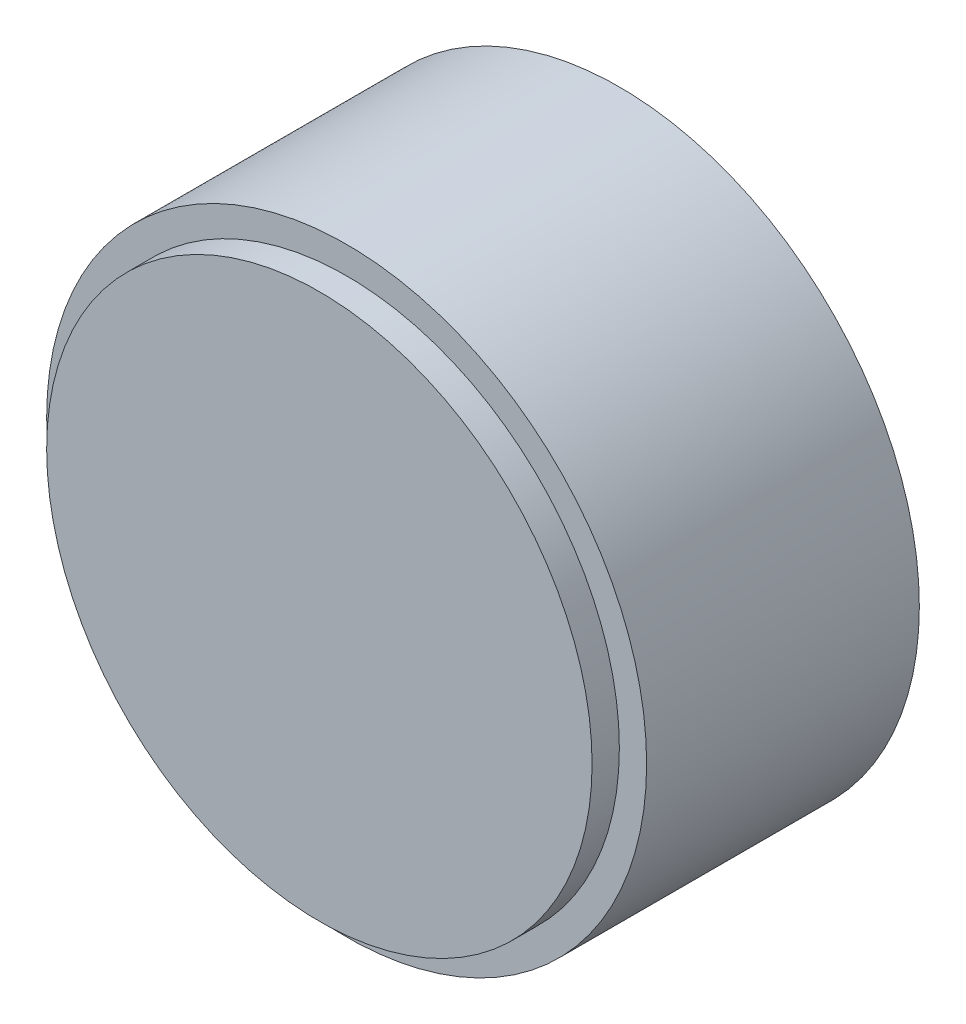
from build123d import *

# Parameters (mm, degrees)
ESQUISSE1_R             = 30
BOSS_EXTRU_1_DEPTH      = 35
BOSS_EXTRU_2_START      = -2
ESQUISSE3_R             = 33
ESQUISSE3_R_2           = 30
BOSS_EXTRU_2_DEPTH      = 30
ESQUISSE4_R             = 7
ESQUISSE4_R_2           = 2
BOSS_EXTRU_3_DEPTH      = 5
ESQUISSE5_R             = 1.5
ENL_V_MAT_EXTRU_1_DEPTH = 59.335238064


with BuildPart() as part:
    # Esquisse1 → Boss.-Extru.1 (new body)
    with BuildSketch(Plane.XY):
        Circle(ESQUISSE1_R)
    extrude(amount=BOSS_EXTRU_1_DEPTH)

    # Esquisse3 → Boss.-Extru.2 (add)
    with BuildSketch(Plane(origin=(0, 0, 0), x_dir=(-1, 0, 0), z_dir=(0, 0, -1)).offset(BOSS_EXTRU_2_START)):
        Circle(ESQUISSE3_R)
        Circle(ESQUISSE3_R_2, mode=Mode.SUBTRACT)
    extrude(amount=-BOSS_EXTRU_2_DEPTH)

    # Esquisse4 → Boss.-Extru.3 (add)
    with BuildSketch(Plane(origin=(0, 0, 0), x_dir=(-1, 0, 0), z_dir=(0, 0, -1))):
        Circle(ESQUISSE4_R)
        Circle(ESQUISSE4_R_2, mode=Mode.SUBTRACT)
    extrude(amount=BOSS_EXTRU_3_DEPTH)

    # Esquisse5 → Enlèv. mat.-Extru.1 (cut, through all)
    with BuildSketch(Plane(origin=(0, 0, 0), x_dir=(1, 0, 0), z_dir=(0, 1, 0))):
        with Locations(Location((0, 2.5, 0), (0, 0, 90))):
            Circle(ESQUISSE5_R)
    extrude(amount=ENL_V_MAT_EXTRU_1_DEPTH, mode=Mode.SUBTRACT)


solid = part.part
